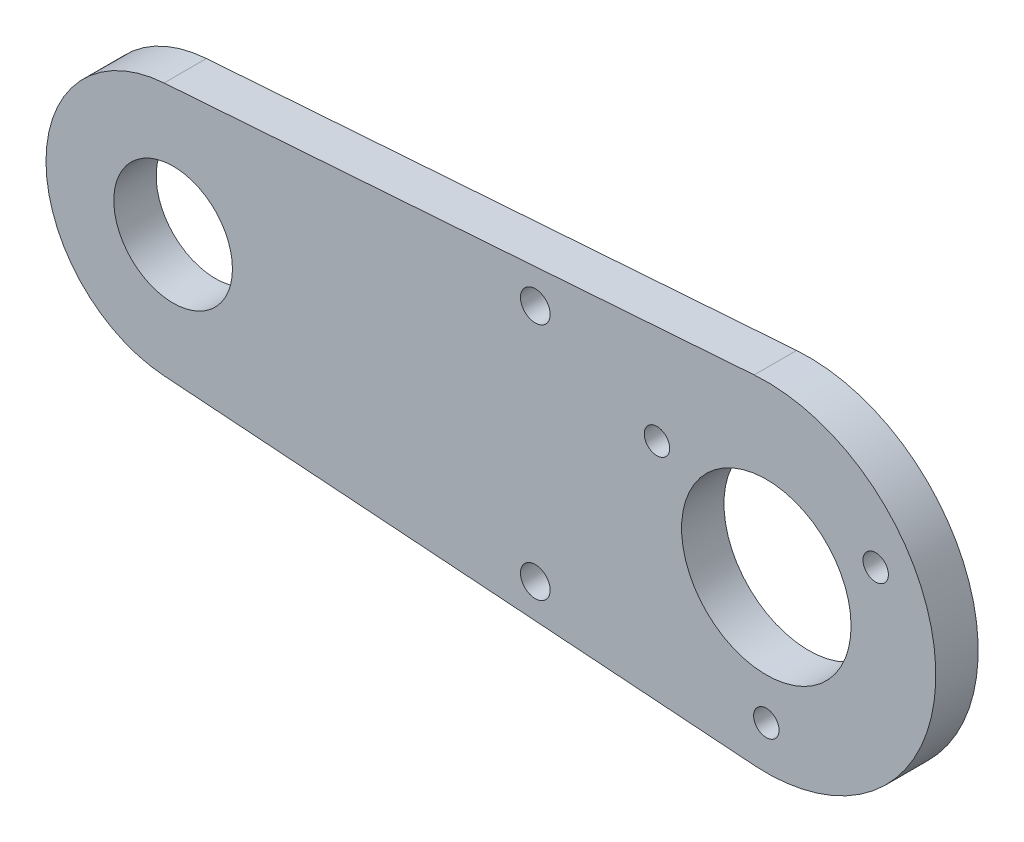
from build123d import *

# Parameters (mm, degrees)
SKETCH1_R           = 7
SKETCH1_R_2         = 10
SKETCH1_R_3         = 1.5
SKETCH1_R_4         = 1.75
BOSS_EXTRUDE1_DEPTH = 5


with BuildPart() as part:
    # Sketch1 → Boss-Extrude1 (new body)
    with BuildSketch(Plane.XY):
        with BuildLine():
            Line((-71.071428571, 14.961685761), (-1.428571429, 19.948914348))
            ThreePointArc((-1.428571429, 19.948914348), (20, 0), (-1.428571429, -19.948914348))
            Line((-1.428571429, -19.948914348), (-71.071428571, -14.961685761))
            ThreePointArc((-71.071428571, -14.961685761), (-85, 0), (-71.071428571, 14.961685761))
        make_face()
        with Locations((-70, 0)):
            Circle(SKETCH1_R, mode=Mode.SUBTRACT)
        Circle(SKETCH1_R_2, mode=Mode.SUBTRACT)
        with Locations((-12.903778516, 7.45)):
            Circle(SKETCH1_R_3, mode=Mode.SUBTRACT)
        with Locations((0, -14.9)):
            Circle(SKETCH1_R_3, mode=Mode.SUBTRACT)
        with Locations((-27.262321561, 14.088677781)):
            Circle(SKETCH1_R_4, mode=Mode.SUBTRACT)
        with Locations((-27.262321561, -14.088677781)):
            Circle(SKETCH1_R_4, mode=Mode.SUBTRACT)
        with Locations((12.903778516, 7.45)):
            Circle(SKETCH1_R_3, mode=Mode.SUBTRACT)
    extrude(amount=BOSS_EXTRUDE1_DEPTH)


solid = part.part
